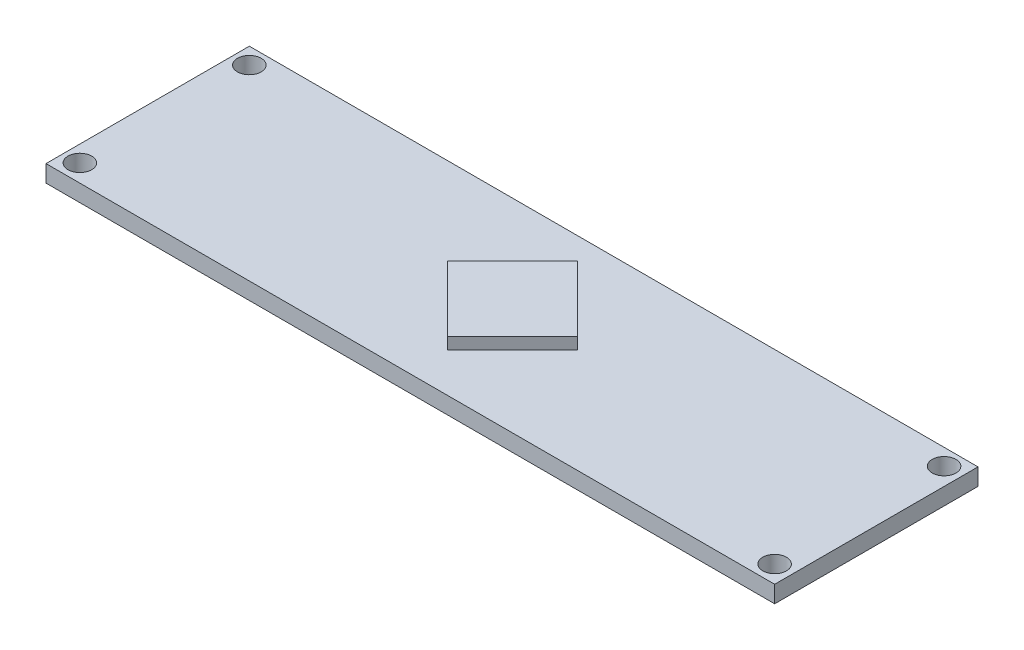
from build123d import *

# Parameters (mm, degrees)
SKETCH1_W           = 43
SKETCH1_H           = 12
SKETCH1_R           = 0.7
BOSS_EXTRUDE1_DEPTH = 1
BOSS_EXTRUDE2_DEPTH = 0.7


with BuildPart() as part:
    # Sketch1 → Boss-Extrude1 (new body)
    with BuildSketch(Plane(origin=(0, 0, 0), x_dir=(1, 0, 0), z_dir=(0, 1, 0))):
        Rectangle(SKETCH1_W, SKETCH1_H)
        with Locations(Location((-20.534424833, -4.967025936, 0), (0, 0, 270))):
            Circle(SKETCH1_R, mode=Mode.SUBTRACT)
        with Locations(Location((20.465575167, -4.967025936, 0), (0, 0, 270))):
            Circle(SKETCH1_R, mode=Mode.SUBTRACT)
        with Locations(Location((20.465575167, 5.032974064, 0), (0, 0, 270))):
            Circle(SKETCH1_R, mode=Mode.SUBTRACT)
        with Locations(Location((-20.534424833, 5.032974064, 0), (0, 0, 270))):
            Circle(SKETCH1_R, mode=Mode.SUBTRACT)
    extrude(amount=BOSS_EXTRUDE1_DEPTH)

    # Sketch3 → Boss-Extrude2 (add)
    with BuildSketch(Plane(origin=(0, 1, 0), x_dir=(1, 0, 0), z_dir=(0, 1, 0))):
        Polygon((-3.980927617, 0.159893843), (-0.131379893, 4.009441567), (3.71816783, 0.159893843), (-0.131379893, -3.68965388), align=None)
    extrude(amount=BOSS_EXTRUDE2_DEPTH)


solid = part.part
